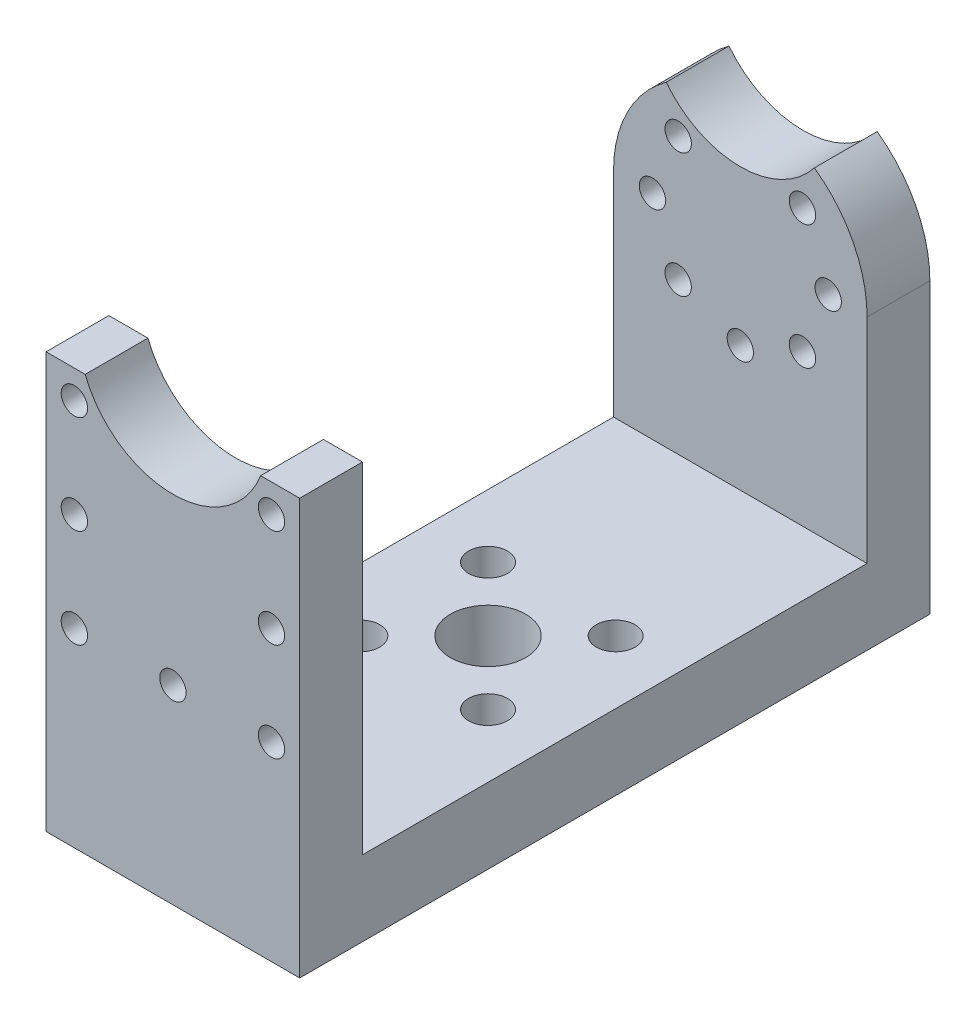
from build123d import *

# Parameters (mm, degrees)
BOSS_EXTRUDE1_DEPTH = 50.2
CUT_EXTRUDE2_DEPTH  = 44.2
SKETCH3_W           = 20.2
SKETCH3_H           = 10.1
BOSS_EXTRUDE2_DEPTH = 5
SKETCH4_R           = 1.05
CUT_EXTRUDE3_DEPTH  = 11
SKETCH5_R           = 4
SKETCH5_R_2         = 7.5
CUT_EXTRUDE4_DEPTH  = 11
SKETCH6_R           = 4
BOSS_EXTRUDE3_DEPTH = 5
SKETCH7_R           = 4
SKETCH7_R_2         = 1.05
CUT_EXTRUDE5_DEPTH  = 16
SKETCH8_R           = 7.5
CUT_EXTRUDE6_DEPTH  = 11
SKETCH9_R           = 4
BOSS_EXTRUDE4_DEPTH = 5
SKETCH11_W          = 20.2
SKETCH11_H          = 50.2
BOSS_EXTRUDE5_DEPTH = 3
SKETCH12_R          = 3
SKETCH12_R_2        = 1.55
CUT_EXTRUDE8_DEPTH  = 23


with BuildPart() as part:
    # Sketch1 → Boss-Extrude1 (new body)
    with BuildSketch(Plane.XY):
        with BuildLine():
            Line((-10.1, 0), (-10.1, -20))
            Line((-10.1, -20), (10.1, -20))
            Line((10.1, -20), (10.1, 0))
            ThreePointArc((10.1, 0), (0, 10.1), (-10.1, 0))
        make_face()
    extrude(amount=BOSS_EXTRUDE1_DEPTH)

    # Sketch2 → Cut-Extrude2 (cut)
    with BuildSketch(Plane.ZY.offset(10.1)):
        Polygon((5, -10), (5, -17), (45.2, -17), (45.2, -10), (45.2, 11.866817026), (5, 11.866817026), align=None)
    extrude(amount=-CUT_EXTRUDE2_DEPTH, mode=Mode.SUBTRACT)

    # Sketch3 → Boss-Extrude2 (add)
    with BuildSketch(Plane.XY.offset(50.2)):
        with Locations((0, 5.05)):
            Rectangle(SKETCH3_W, SKETCH3_H)
    extrude(amount=-BOSS_EXTRUDE2_DEPTH)

    # Sketch4 → Cut-Extrude3 (cut, symmetric)
    with BuildSketch(Plane.XY.offset(50.2)):
        with Locations((-7.85, 7.85)):
            Circle(SKETCH4_R)
        with Locations((7.85, 7.85)):
            Circle(SKETCH4_R)
        with Locations((-7.85, -7.85)):
            Circle(SKETCH4_R)
        with Locations((7.85, -7.85)):
            Circle(SKETCH4_R)
        with Locations((0, 7.85)):
            Circle(SKETCH4_R)
        with Locations((0, -7.85)):
            Circle(SKETCH4_R)
        with Locations((-7.85, 0)):
            Circle(SKETCH4_R)
        with Locations((7.85, 0)):
            Circle(SKETCH4_R)
    extrude(amount=CUT_EXTRUDE3_DEPTH, both=True, mode=Mode.SUBTRACT)

    # Sketch5 → Cut-Extrude4 (cut, symmetric)
    with BuildSketch(Plane.XY.offset(50.2)):
        Circle(SKETCH5_R)
        with Locations((0, 12.82)):
            Circle(SKETCH5_R_2)
    extrude(amount=CUT_EXTRUDE4_DEPTH, both=True, mode=Mode.SUBTRACT)

    # Sketch6 → Boss-Extrude3 (add)
    with BuildSketch(Plane.XY.offset(50.2)):
        Circle(SKETCH6_R)
    extrude(amount=-BOSS_EXTRUDE3_DEPTH)

    # Sketch7 → Cut-Extrude5 (cut, symmetric)
    with BuildSketch(Plane(origin=(0, 0, 0), x_dir=(-1, 0, 0), z_dir=(0, 0, -1))):
        with Locations(Location((0, 0, 0), (0, 0, 90))):
            Circle(SKETCH7_R)
        with Locations(Location((0, 7, 0), (0, 0, 90))):
            Circle(SKETCH7_R_2)
        with Locations(Location((-4.949747468, 4.949747468, 0), (0, 0, 90))):
            Circle(SKETCH7_R_2)
        with Locations(Location((-7, 0, 0), (0, 0, 90))):
            Circle(SKETCH7_R_2)
        with Locations(Location((-4.949747468, -4.949747468, 0), (0, 0, 90))):
            Circle(SKETCH7_R_2)
        with Locations(Location((0, -7, 0), (0, 0, 90))):
            Circle(SKETCH7_R_2)
        with Locations(Location((4.949747468, -4.949747468, 0), (0, 0, 90))):
            Circle(SKETCH7_R_2)
        with Locations(Location((7, 0, 0), (0, 0, 90))):
            Circle(SKETCH7_R_2)
        with Locations(Location((4.949747468, 4.949747468, 0), (0, 0, 90))):
            Circle(SKETCH7_R_2)
    extrude(amount=CUT_EXTRUDE5_DEPTH, both=True, mode=Mode.SUBTRACT)

    # Sketch8 → Cut-Extrude6 (cut, symmetric)
    with BuildSketch(Plane(origin=(0, 0, 0), x_dir=(-1, 0, 0), z_dir=(0, 0, -1))):
        with Locations((0, 12.82)):
            Circle(SKETCH8_R)
    extrude(amount=CUT_EXTRUDE6_DEPTH, both=True, mode=Mode.SUBTRACT)

    # Sketch9 → Boss-Extrude4 (add)
    with BuildSketch(Plane(origin=(0, 0, 0), x_dir=(-1, 0, 0), z_dir=(0, 0, -1))):
        Circle(SKETCH9_R)
    extrude(amount=-BOSS_EXTRUDE4_DEPTH)

    # Sketch11 → Boss-Extrude5 (add)
    with BuildSketch(Plane(origin=(0, -20, 0), x_dir=(-1, 0, 0), z_dir=(0, -1, 0))):
        with Locations((0, -25.1)):
            Rectangle(SKETCH11_W, SKETCH11_H)
    extrude(amount=BOSS_EXTRUDE5_DEPTH)

    # Sketch12 → Cut-Extrude8 (cut)
    with BuildSketch(Plane(origin=(0, -17, 0), x_dir=(1, 0, 0), z_dir=(0, 1, 0))):
        with Locations(Location((0, -25.1, 0), (0, 0, 270))):
            Circle(SKETCH12_R)
        with Locations(Location((-5.084097757, -20.015902243, 0), (0, 0, 270))):
            Circle(SKETCH12_R_2)
        with Locations(Location((5.084097757, -20.015902243, 0), (0, 0, 270))):
            Circle(SKETCH12_R_2)
        with Locations(Location((5.084097757, -30.184097757, 0), (0, 0, 270))):
            Circle(SKETCH12_R_2)
        with Locations(Location((-5.084097757, -30.184097757, 0), (0, 0, 270))):
            Circle(SKETCH12_R_2)
    extrude(amount=-CUT_EXTRUDE8_DEPTH, mode=Mode.SUBTRACT)


solid = part.part
